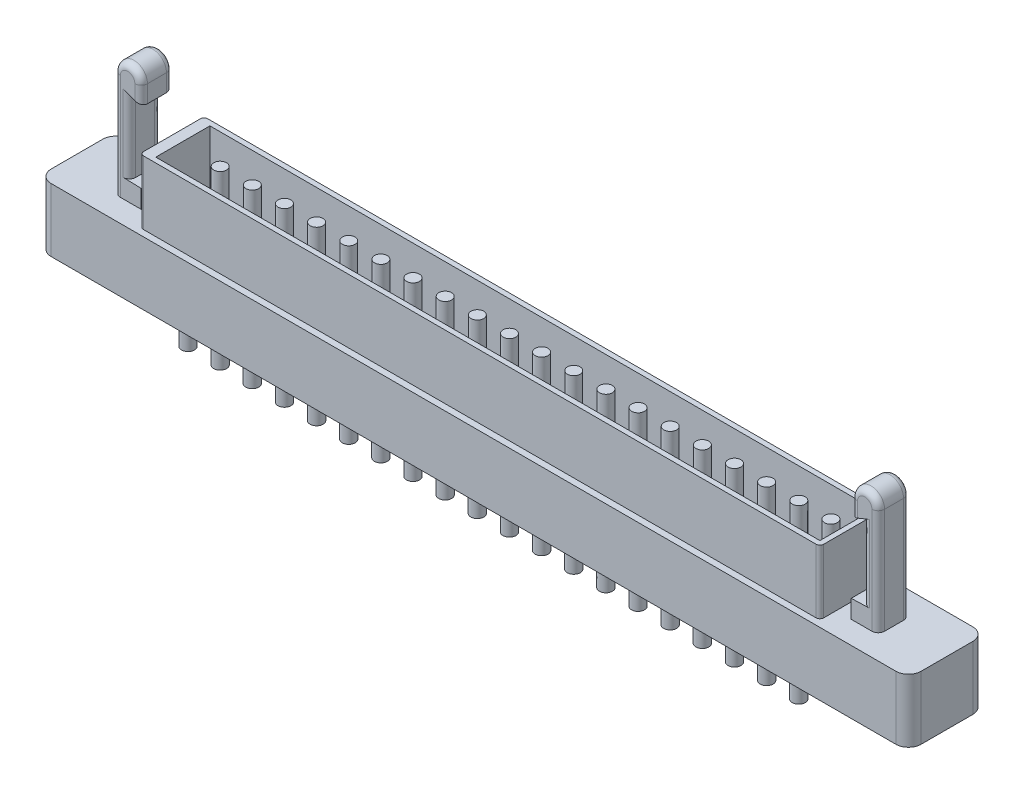
from build123d import *

# Parameters (mm, degrees)
SKETCH_2_W             = 25.4
SKETCH_2_H             = 1
EXTRUDE_1_DEPTH        = 5.08
SKETCH_3_R             = 0.514113779
SKETCH_3_R_2           = 0.502427848
EXTRUDE_2_DEPTH        = 2.5
PATTERN_LINEAR_1_COUNT = 20
PATTERN_LINEAR_1_PITCH = 2.54
SKETCH_4_W             = 72.933344665
SKETCH_4_H             = 8.471214157
CUT_EXTRUDE_1_DEPTH    = 5.08
EXTRUDE_START          = 6
SKETCH_5_R             = 0.514113779
SKETCH_5_R_2           = 0.502427848
EXTRUDE_3_DEPTH        = 6
SKETCH_6_W             = 74.1
SKETCH_6_H             = 6.08
EXTRUDE_4_DEPTH        = 2.4
SKETCH_7_W             = 53.74
SKETCH_7_H             = 5.08
SKETCH_7_W_2           = 52.479365719
SKETCH_7_H_2           = 4.28
EXTRUDE_6_DEPTH        = 7.5
SKETCH_8_W             = 74.1
SKETCH_8_H             = 6.08
EXTRUDE_7_DEPTH        = 2.6
EXTRUDE_8_DEPTH        = 1.25
EXTRUDE_8_DEPTH_BACK   = 1.25
FILLET_1_R             = 0.3
FILLET_2_R             = 0.5
SKETCH_10_W            = 6.08
SKETCH_10_H            = 5
CUT_EXTRUDE_2_DEPTH    = 10.36
SKETCH_11_W            = 6.08
SKETCH_11_H            = 5
EXTRUDE_9_DEPTH        = 2.5
SKETCH_12_W            = 6.08
SKETCH_12_H            = 5
EXTRUDE_10_DEPTH       = 2.5
FILLET_3_R             = 1


with BuildPart() as part:
    # Эскиз2 → Вытянуть1 (new body)
    with BuildSketch(Plane.XY):
        Polygon((0, 0), (64.1, 0), (64.1, 2.54), (63.8, 2.54), (63.8, 3.34), (64.1, 3.34), (64.1, 7.62), (0, 7.62), (0, 3.34), (0.3, 3.34), (0.3, 2.54), (0, 2.54), align=None)
        with Locations((32.05, 5.5)):
            Rectangle(SKETCH_2_W, SKETCH_2_H, mode=Mode.SUBTRACT)
    extrude(amount=EXTRUDE_1_DEPTH)

    # Эскиз3 → Вытянуть2 (add)
    with BuildSketch(Plane.XZ):
        with Locations(Location((2.54, 3.81, 0), (0, 0, 90))):
            Circle(SKETCH_3_R)
        with Locations(Location((2.54, 1.27, 0), (0, 0, 90))):
            Circle(SKETCH_3_R_2)
    extrude_2 = extrude(amount=EXTRUDE_2_DEPTH)

    # Линейный массив1: Вытянуть2 ×20
    with Locations(*[(i * PATTERN_LINEAR_1_PITCH, 0, 0) for i in range(1, PATTERN_LINEAR_1_COUNT)]):
        add(extrude_2)

    # Эскиз4 → Вырез-Вытянуть1 (cut)
    with BuildSketch(Plane(origin=(0, 7.62, 0), x_dir=(-1, 0, 0), z_dir=(0, 1, 0))):
        with Locations((-35.328652619, 2.444099463)):
            Rectangle(SKETCH_4_W, SKETCH_4_H)
    extrude(amount=-CUT_EXTRUDE_1_DEPTH, mode=Mode.SUBTRACT)

    # Эскиз5 → Вытянуть3 (add)
    with BuildSketch(Plane(origin=(0, 2.54, 0), x_dir=(-1, 0, 0), z_dir=(0, 1, 0)).offset(EXTRUDE_START)):
        with Locations(Location((-15.24, 3.81, 0), (0, 0, 90))):
            Circle(SKETCH_5_R)
        with Locations(Location((-15.24, 1.27, 0), (0, 0, 90))):
            Circle(SKETCH_5_R_2)
        with Locations(Location((-17.78, 1.27, 0), (0, 0, 90))):
            Circle(SKETCH_5_R_2)
        with Locations(Location((-17.78, 3.81, 0), (0, 0, 90))):
            Circle(SKETCH_5_R)
        with Locations(Location((-20.32, 3.81, 0), (0, 0, 90))):
            Circle(SKETCH_5_R)
        with Locations(Location((-20.32, 1.27, 0), (0, 0, 90))):
            Circle(SKETCH_5_R_2)
        with Locations(Location((-22.86, 1.27, 0), (0, 0, 90))):
            Circle(SKETCH_5_R_2)
        with Locations(Location((-12.7, 3.81, 0), (0, 0, 90))):
            Circle(SKETCH_5_R)
        with Locations(Location((-10.16, 3.81, 0), (0, 0, 90))):
            Circle(SKETCH_5_R)
        with Locations(Location((-7.62, 3.81, 0), (0, 0, 90))):
            Circle(SKETCH_5_R)
        with Locations(Location((-5.08, 3.81, 0), (0, 0, 90))):
            Circle(SKETCH_5_R)
        with Locations(Location((-2.54, 3.81, 0), (0, 0, 90))):
            Circle(SKETCH_5_R)
        with Locations(Location((-2.54, 1.27, 0), (0, 0, 90))):
            Circle(SKETCH_5_R_2)
        with Locations(Location((-5.08, 1.27, 0), (0, 0, 90))):
            Circle(SKETCH_5_R_2)
        with Locations(Location((-7.62, 1.27, 0), (0, 0, 90))):
            Circle(SKETCH_5_R_2)
        with Locations(Location((-10.16, 1.27, 0), (0, 0, 90))):
            Circle(SKETCH_5_R_2)
        with Locations(Location((-12.7, 1.27, 0), (0, 0, 90))):
            Circle(SKETCH_5_R_2)
        with Locations(Location((-22.86, 3.81, 0), (0, 0, 90))):
            Circle(SKETCH_5_R)
        with Locations(Location((-25.4, 3.81, 0), (0, 0, 90))):
            Circle(SKETCH_5_R)
        with Locations(Location((-27.94, 1.27, 0), (0, 0, 90))):
            Circle(SKETCH_5_R_2)
        with Locations(Location((-25.4, 1.27, 0), (0, 0, 90))):
            Circle(SKETCH_5_R_2)
        with Locations(Location((-30.48, 1.27, 0), (0, 0, 90))):
            Circle(SKETCH_5_R_2)
        with Locations(Location((-30.48, 3.81, 0), (0, 0, 90))):
            Circle(SKETCH_5_R)
        with Locations(Location((-27.94, 3.81, 0), (0, 0, 90))):
            Circle(SKETCH_5_R)
        with Locations(Location((-33.02, 3.81, 0), (0, 0, 90))):
            Circle(SKETCH_5_R)
        with Locations(Location((-33.02, 1.27, 0), (0, 0, 90))):
            Circle(SKETCH_5_R_2)
        with Locations(Location((-35.56, 3.81, 0), (0, 0, 90))):
            Circle(SKETCH_5_R)
        with Locations(Location((-35.56, 1.27, 0), (0, 0, 90))):
            Circle(SKETCH_5_R_2)
        with Locations(Location((-38.1, 3.81, 0), (0, 0, 90))):
            Circle(SKETCH_5_R)
        with Locations(Location((-38.1, 1.27, 0), (0, 0, 90))):
            Circle(SKETCH_5_R_2)
        with Locations(Location((-40.64, 1.27, 0), (0, 0, 90))):
            Circle(SKETCH_5_R_2)
        with Locations(Location((-50.8, 3.81, 0), (0, 0, 90))):
            Circle(SKETCH_5_R)
        with Locations(Location((-43.18, 1.27, 0), (0, 0, 90))):
            Circle(SKETCH_5_R_2)
        with Locations(Location((-43.18, 3.81, 0), (0, 0, 90))):
            Circle(SKETCH_5_R)
        with Locations(Location((-40.64, 3.81, 0), (0, 0, 90))):
            Circle(SKETCH_5_R)
        with Locations(Location((-45.72, 3.81, 0), (0, 0, 90))):
            Circle(SKETCH_5_R)
        with Locations(Location((-45.72, 1.27, 0), (0, 0, 90))):
            Circle(SKETCH_5_R_2)
        with Locations(Location((-48.26, 1.27, 0), (0, 0, 90))):
            Circle(SKETCH_5_R_2)
        with Locations(Location((-48.26, 3.81, 0), (0, 0, 90))):
            Circle(SKETCH_5_R)
        with Locations(Location((-50.8, 1.27, 0), (0, 0, 90))):
            Circle(SKETCH_5_R_2)
    extrude(amount=-EXTRUDE_3_DEPTH)

    # Эскиз6 → Вытянуть4 (add)
    with BuildSketch(Plane.XZ):
        with Locations((32.05, 2.54)):
            Rectangle(SKETCH_6_W, SKETCH_6_H)
    extrude(amount=-EXTRUDE_4_DEPTH)

    # Эскиз7 → Вытянуть6 (add)
    with BuildSketch(Plane(origin=(0, 2.54, 0), x_dir=(-1, 0, 0), z_dir=(0, 1, 0))):
        with Locations((-26.87, 2.54)):
            Rectangle(SKETCH_7_W, SKETCH_7_H)
        with Locations((-27.100317141, 2.54)):
            Rectangle(SKETCH_7_W_2, SKETCH_7_H_2, mode=Mode.SUBTRACT)
    extrude(amount=EXTRUDE_6_DEPTH)

    # Эскиз8 → Вытянуть7 (add)
    with BuildSketch(Plane(origin=(0, 2.4, 0), x_dir=(-1, 0, 0), z_dir=(0, 1, 0))):
        with Locations((-32.05, 2.54)):
            Rectangle(SKETCH_8_W, SKETCH_8_H)
    extrude(amount=EXTRUDE_7_DEPTH)

    # Эскиз9 → Вытянуть8 (add, two sides: drawn at the far end of the back side and taken through both)
    with BuildSketch(Plane.XY.offset(2.54).offset(-EXTRUDE_8_DEPTH_BACK)):
        with BuildLine():
            Line((-3.320885109, 2.225086662), (-1.183113878, 2.225086662))
            Line((-1.183113878, 2.225086662), (-1.183113878, 6.436607112))
            Line((-1.183113878, 6.436607112), (-2.112614583, 6.464724855))
            Line((-2.112614583, 6.464724855), (-2.112614583, 12.347438775))
            Line((-2.112614583, 12.347438775), (-1.183113878, 11.978526903))
            Line((-1.183113878, 11.978526903), (-1.183113878, 13.347619973))
            ThreePointArc((-1.183113878, 13.347619973), (-2.251999493, 14.416505589), (-3.320885109, 13.347619973))
            Line((-3.320885109, 13.347619973), (-3.320885109, 2.225086662))
        make_face()
        with BuildLine():
            Line((54.923113878, 11.978526903), (54.923113878, 13.347619973))
            ThreePointArc((54.923113878, 13.347619973), (55.991999493, 14.416505589), (57.060885109, 13.347619973))
            Line((57.060885109, 13.347619973), (57.060885109, 2.225086662))
            Line((57.060885109, 2.225086662), (54.923113878, 2.225086662))
            Line((54.923113878, 2.225086662), (54.923113878, 6.436607112))
            Line((54.923113878, 6.436607112), (55.852614583, 6.464724855))
            Line((55.852614583, 6.464724855), (55.852614583, 12.347438775))
            Line((55.852614583, 12.347438775), (54.923113878, 11.978526903))
        make_face()
    extrude(amount=EXTRUDE_8_DEPTH + EXTRUDE_8_DEPTH_BACK)

    # Скругление1
    fillet_1_edges = [part.edges().sort_by_distance(p)[0] for p in [
        (0, 7.52, 0),
        (53.74, 7.52, 5.08),
        (53.74, 7.52, 0),
        (0, 7.52, 5.08),
    ]]
    fillet(fillet_1_edges, radius=FILLET_1_R)

    # Скругление2
    fillet_2_edges = [part.edges().sort_by_distance(p)[0] for p in [
        (-3.320885109, 9.173809987, 1.29),
        (-3.320885109, 9.173809987, 3.79),
        (-2.112614583, 9.406081815, 3.79),
        (-1.183113878, 12.663073438, 3.79),
        (-2.251999493, 14.416505589, 3.79),
        (-2.112614583, 9.406081815, 1.29),
        (-1.183113878, 12.663073438, 1.29),
        (-2.251999493, 14.416505589, 1.29),
        (57.060885109, 9.173809987, 1.29),
        (57.060885109, 9.173809987, 3.79),
        (55.991999493, 14.416505589, 3.79),
        (54.923113878, 12.663073438, 3.79),
        (55.852614583, 9.406081815, 3.79),
        (55.991999493, 14.416505589, 1.29),
        (54.923113878, 12.663073438, 1.29),
        (55.852614583, 9.406081815, 1.29),
    ]]
    fillet(fillet_2_edges, radius=FILLET_2_R)

    # Эскиз10 → Вырез-Вытянуть2 (cut)
    with BuildSketch(Plane(origin=(69.1, 0, 0), x_dir=(0, 0, -1), z_dir=(1, 0, 0))):
        with Locations((-2.54, 2.5)):
            Rectangle(SKETCH_10_W, SKETCH_10_H)
    extrude(amount=-CUT_EXTRUDE_2_DEPTH, mode=Mode.SUBTRACT)

    # Эскиз11 → Вытянуть9 (add)
    with BuildSketch(Plane(origin=(58.74, 0, 0), x_dir=(0, 0, -1), z_dir=(1, 0, 0))):
        with Locations((-2.54, 2.5)):
            Rectangle(SKETCH_11_W, SKETCH_11_H)
    extrude(amount=EXTRUDE_9_DEPTH)

    # Эскиз12 → Вытянуть10 (add)
    with BuildSketch(Plane.ZY.offset(5)):
        with Locations((2.54, 2.5)):
            Rectangle(SKETCH_12_W, SKETCH_12_H)
    extrude(amount=EXTRUDE_10_DEPTH)

    # Скругление3
    fillet_3_edges = [part.edges().sort_by_distance(p)[0] for p in [
        (61.24, 2.5, 5.58),
        (61.24, 2.5, -0.5),
        (-7.5, 2.5, -0.5),
        (-7.5, 2.5, 5.58),
    ]]
    fillet(fillet_3_edges, radius=FILLET_3_R)


solid = part.part
